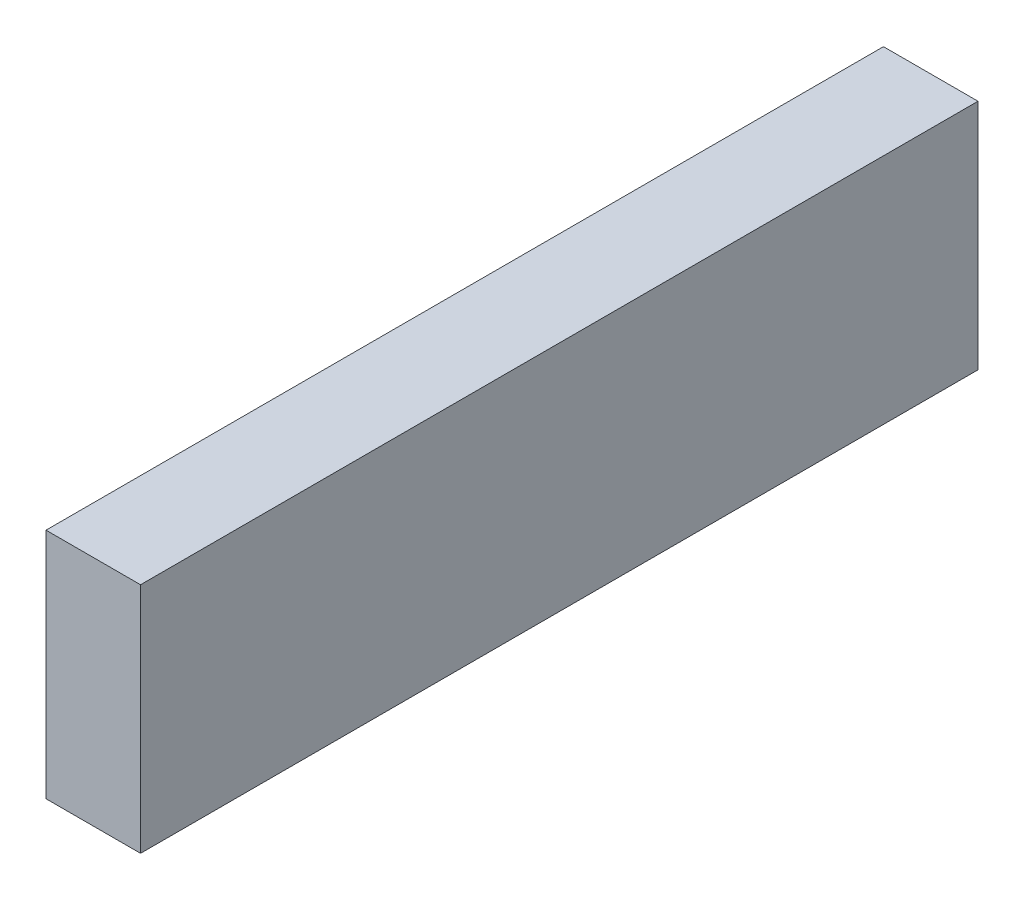
from build123d import *

# Parameters (mm, degrees)
CROQUIS1_W              = 101.6
CROQUIS1_H              = 250
SALIENTE_EXTRUIR1_DEPTH = 900


with BuildPart() as part:
    # Croquis1 → Saliente-Extruir1 (new body)
    with BuildSketch(Plane.XY):
        with Locations((50.8, -125)):
            Rectangle(CROQUIS1_W, CROQUIS1_H)
    extrude(amount=SALIENTE_EXTRUIR1_DEPTH)


solid = part.part
